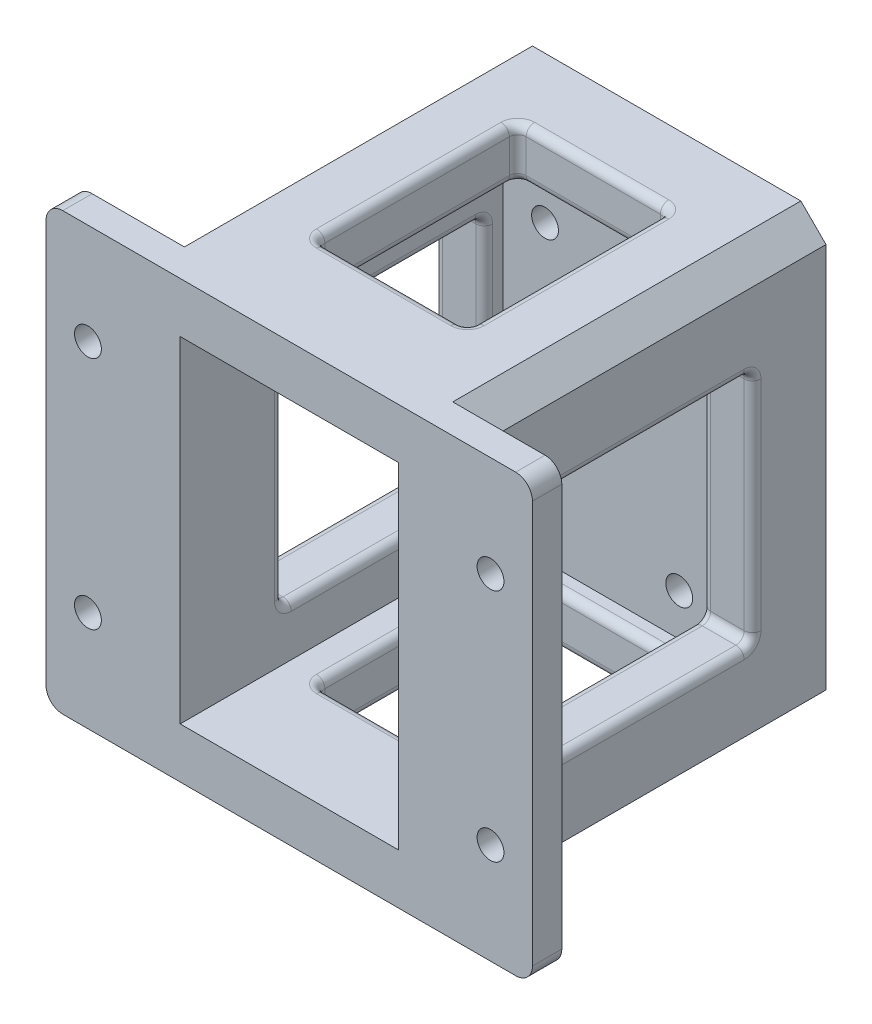
from build123d import *

# Parameters (mm, degrees)
SKETCH_1_W          = 26
SKETCH_1_H          = 40
EXTRUDE_1_DEPTH     = 6.5
CUT_EXTRUDE_1_REACH = 32.167
SKETCH_1_3_R        = 1.6
SKETCH_1_4_W        = 38
SKETCH_1_4_H        = 52
SKETCH_1_4_W_2      = 26
SKETCH_1_4_H_2      = 40
EXTRUDE_2_DEPTH     = 45
SKETCH_3_W          = 10
SKETCH_3_H          = 52
EXTRUDE_1_2_DEPTH   = 3.5
SKETCH_3_4_W        = 10
SKETCH_3_4_H        = 52
EXTRUDE_2_2_DEPTH   = 3.5
CUT_EXTRUDE_2_REACH = 64.951
SKETCH_3_5_R        = 1.6
FILLET_1_R          = 2
CHAMFER_1_SIZE      = 3
CUT_EXTRUDE_3_REACH = 74.947
SKETCH_4_W          = 24
SKETCH_4_H          = 28
SKETCH_5_W          = 18
SKETCH_5_H          = 24
CUT_EXTRUDE_4_DEPTH = 76.329692021
FILLET_2_R          = 1


with BuildPart() as part:
    # 草图1 → Extrude 1 (new body)
    with BuildSketch(Plane.XY):
        with Locations((-1.75, 5.5)):
            Rectangle(SKETCH_1_W, SKETCH_1_H)
    extrude(amount=EXTRUDE_1_DEPTH)

    # 草图1<3> → 切除-拉伸1 (cut, up to next)
    with BuildSketch(Plane.XY, mode=Mode.PRIVATE) as cut_extrude_1_sk1:
        with Locations(Location((-9.75, 20.5, 0), (0, 0, 180))):
            Circle(SKETCH_1_3_R)
    cut_extrude_1_tool1 = extrude(cut_extrude_1_sk1.sketch, amount=CUT_EXTRUDE_1_REACH, mode=Mode.PRIVATE) & part.part
    # 草图1<3> → 切除-拉伸1 (cut, up to next)
    with BuildSketch(Plane.XY, mode=Mode.PRIVATE) as cut_extrude_1_sk2:
        with Locations(Location((6.25, 20.5, 0), (0, 0, 180))):
            Circle(SKETCH_1_3_R)
    cut_extrude_1_tool2 = extrude(cut_extrude_1_sk2.sketch, amount=CUT_EXTRUDE_1_REACH, mode=Mode.PRIVATE) & part.part
    # 草图1<3> → 切除-拉伸1 (cut, up to next)
    with BuildSketch(Plane.XY, mode=Mode.PRIVATE) as cut_extrude_1_sk3:
        with Locations(Location((-9.75, -9.5, 0), (0, 0, 180))):
            Circle(SKETCH_1_3_R)
    cut_extrude_1_tool3 = extrude(cut_extrude_1_sk3.sketch, amount=CUT_EXTRUDE_1_REACH, mode=Mode.PRIVATE) & part.part
    # 草图1<3> → 切除-拉伸1 (cut, up to next)
    with BuildSketch(Plane.XY, mode=Mode.PRIVATE) as cut_extrude_1_sk4:
        with Locations(Location((6.25, -9.5, 0), (0, 0, 180))):
            Circle(SKETCH_1_3_R)
    cut_extrude_1_tool4 = extrude(cut_extrude_1_sk4.sketch, amount=CUT_EXTRUDE_1_REACH, mode=Mode.PRIVATE) & part.part
    add(cut_extrude_1_tool1.solids().sort_by_distance((-9.75, 20.5, 0))[0], mode=Mode.SUBTRACT)
    add(cut_extrude_1_tool2.solids().sort_by_distance((6.25, 20.5, 0))[0], mode=Mode.SUBTRACT)
    add(cut_extrude_1_tool3.solids().sort_by_distance((-9.75, -9.5, 0))[0], mode=Mode.SUBTRACT)
    add(cut_extrude_1_tool4.solids().sort_by_distance((6.25, -9.5, 0))[0], mode=Mode.SUBTRACT)

    # 草图1<4> → Extrude 2 (add)
    with BuildSketch(Plane.XY):
        with Locations((-1.75, 5.5)):
            Rectangle(SKETCH_1_4_W, SKETCH_1_4_H)
        with Locations((-1.75, 5.5)):
            Rectangle(SKETCH_1_4_W_2, SKETCH_1_4_H_2, mode=Mode.SUBTRACT)
    extrude(amount=EXTRUDE_2_DEPTH)

    # 草图3 → Extrude 1 2 (add)
    with BuildSketch(Plane.XY.offset(45)):
        with Locations((-25.75, 5.5)):
            Rectangle(SKETCH_3_W, SKETCH_3_H)
    extrude(amount=-EXTRUDE_1_2_DEPTH)

    # 草图3<4> → Extrude 2 2 (add)
    with BuildSketch(Plane.XY.offset(45)):
        with Locations((22.25, 5.5)):
            Rectangle(SKETCH_3_4_W, SKETCH_3_4_H)
    extrude(amount=-EXTRUDE_2_2_DEPTH)

    # 草图3<5> → 切除-拉伸2 (cut, up to next)
    with BuildSketch(Plane.XY.offset(45), mode=Mode.PRIVATE) as cut_extrude_2_sk1:
        with Locations((-25.75, 19.5)):
            Circle(SKETCH_3_5_R)
    cut_extrude_2_tool1 = extrude(cut_extrude_2_sk1.sketch, amount=-CUT_EXTRUDE_2_REACH, mode=Mode.PRIVATE) & part.part
    # 草图3<5> → 切除-拉伸2 (cut, up to next)
    with BuildSketch(Plane.XY.offset(45), mode=Mode.PRIVATE) as cut_extrude_2_sk2:
        with Locations(Location((22.25, 19.5, 0), (0, 0, 180))):
            Circle(SKETCH_3_5_R)
    cut_extrude_2_tool2 = extrude(cut_extrude_2_sk2.sketch, amount=-CUT_EXTRUDE_2_REACH, mode=Mode.PRIVATE) & part.part
    # 草图3<5> → 切除-拉伸2 (cut, up to next)
    with BuildSketch(Plane.XY.offset(45), mode=Mode.PRIVATE) as cut_extrude_2_sk3:
        with Locations((-25.75, -8.5)):
            Circle(SKETCH_3_5_R)
    cut_extrude_2_tool3 = extrude(cut_extrude_2_sk3.sketch, amount=-CUT_EXTRUDE_2_REACH, mode=Mode.PRIVATE) & part.part
    # 草图3<5> → 切除-拉伸2 (cut, up to next)
    with BuildSketch(Plane.XY.offset(45), mode=Mode.PRIVATE) as cut_extrude_2_sk4:
        with Locations(Location((22.25, -8.5, 0), (0, 0, 180))):
            Circle(SKETCH_3_5_R)
    cut_extrude_2_tool4 = extrude(cut_extrude_2_sk4.sketch, amount=-CUT_EXTRUDE_2_REACH, mode=Mode.PRIVATE) & part.part
    add(cut_extrude_2_tool1.solids().sort_by_distance((-25.75, 19.5, 45))[0], mode=Mode.SUBTRACT)
    add(cut_extrude_2_tool2.solids().sort_by_distance((22.25, 19.5, 45))[0], mode=Mode.SUBTRACT)
    add(cut_extrude_2_tool3.solids().sort_by_distance((-25.75, -8.5, 45))[0], mode=Mode.SUBTRACT)
    add(cut_extrude_2_tool4.solids().sort_by_distance((22.25, -8.5, 45))[0], mode=Mode.SUBTRACT)

    # 圆角1
    fillet_1_edges = [part.edges().sort_by_distance(p)[0] for p in [
        (-30.75, -20.5, 43.25),
        (-30.75, 31.5, 43.25),
        (27.25, 31.5, 43.25),
        (27.25, -20.5, 43.25),
    ]]
    fillet(fillet_1_edges, radius=FILLET_1_R)

    # 倒角1
    chamfer_1_edges = [part.edges().sort_by_distance(p)[0] for p in [
        (-20.75, -20.5, 20.75),
        (-20.75, 31.5, 20.75),
        (17.25, 31.5, 20.75),
        (17.25, -20.5, 20.75),
    ]]
    chamfer(chamfer_1_edges, length=CHAMFER_1_SIZE)

    # 草图4 → 切除-拉伸3 (cut, up to next)
    with BuildSketch(Plane.ZY.offset(20.75), mode=Mode.PRIVATE) as cut_extrude_3_sk1:
        with Locations((20.75, 5.5)):
            Rectangle(SKETCH_4_W, SKETCH_4_H)
    cut_extrude_3_tool1 = extrude(cut_extrude_3_sk1.sketch, amount=-CUT_EXTRUDE_3_REACH, mode=Mode.PRIVATE) & part.part
    cut_extrude_3 = cut_extrude_3_tool1.solids().sort_by_distance((-20.75, 5.5, 20.75))[0]
    add(cut_extrude_3, mode=Mode.SUBTRACT)

    # 镜向1: 切除-拉伸3 across plane
    add(cut_extrude_3.mirror(Plane.ZY.offset(1.75)), mode=Mode.SUBTRACT)

    # 草图5 → 切除-拉伸4 (cut, through all)
    with BuildSketch(Plane(origin=(0, 31.5, 0), x_dir=(1, 0, 0), z_dir=(0, 1, 0))):
        with Locations((-1.75, -20.75)):
            Rectangle(SKETCH_5_W, SKETCH_5_H)
    extrude(amount=-CUT_EXTRUDE_4_DEPTH, mode=Mode.SUBTRACT)

    # 圆角2
    fillet_2_edges = [part.edges().sort_by_distance(p)[0] for p in [
        (-14.75, 5.5, 8.75),
        (-17.75, -8.5, 8.75),
        (-14.75, 19.5, 20.75),
        (-17.75, 19.5, 8.75),
        (-14.75, 5.5, 32.75),
        (-17.75, 19.5, 32.75),
        (-14.75, -8.5, 20.75),
        (-17.75, -8.5, 32.75),
        (-20.75, 5.5, 8.75),
        (-20.75, -8.5, 20.75),
        (-20.75, 5.5, 32.75),
        (-20.75, 19.5, 20.75),
        (11.25, 5.5, 8.75),
        (14.25, 19.5, 8.75),
        (17.25, 5.5, 8.75),
        (11.25, -8.5, 20.75),
        (14.25, -8.5, 8.75),
        (17.25, -8.5, 20.75),
        (11.25, 5.5, 32.75),
        (14.25, -8.5, 32.75),
        (17.25, 5.5, 32.75),
        (11.25, 19.5, 20.75),
        (14.25, 19.5, 32.75),
        (17.25, 19.5, 20.75),
        (-10.75, 25.5, 20.75),
        (-10.75, 28.5, 32.75),
        (-10.75, -14.5, 20.75),
        (-1.75, 25.5, 8.75),
        (-10.75, 28.5, 8.75),
        (-1.75, -14.5, 8.75),
        (7.25, 25.5, 20.75),
        (7.25, 28.5, 8.75),
        (7.25, -14.5, 20.75),
        (-1.75, 25.5, 32.75),
        (7.25, 28.5, 32.75),
        (-1.75, -14.5, 32.75),
        (-10.75, -20.5, 20.75),
        (-10.75, -17.5, 32.75),
        (-1.75, -20.5, 8.75),
        (-10.75, -17.5, 8.75),
        (7.25, -20.5, 20.75),
        (7.25, -17.5, 8.75),
        (-1.75, -20.5, 32.75),
        (7.25, -17.5, 32.75),
        (-10.75, 31.5, 20.75),
        (-1.75, 31.5, 32.75),
        (7.25, 31.5, 20.75),
        (-1.75, 31.5, 8.75),
    ]]
    fillet(fillet_2_edges, radius=FILLET_2_R)


solid = part.part
